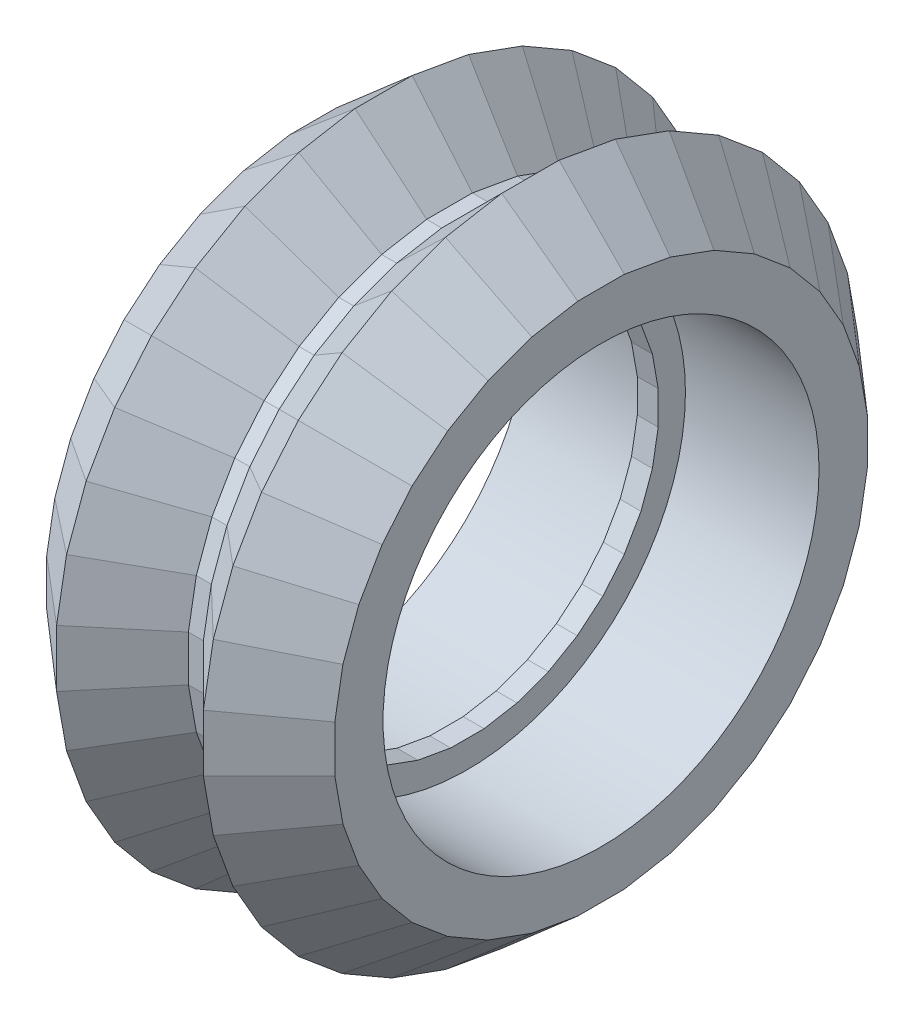
from build123d import *

# Parameters (mm, degrees)
SKETCH3_R          = 8
CUT_EXTRUDE1_DEPTH = 5
CUT_EXTRUDE2_START = 5
SKETCH4_R          = 8
CUT_EXTRUDE2_DEPTH = 5


with BuildPart() as part:
    # Sweep3: sweep along a path in Sketch2
    with BuildLine(Plane(origin=(0, 0, 0), x_dir=(0, 0, -1), z_dir=(1, 0, 0))) as sweep3_path:
        Line((3.117692302, -11.635386072), (5.090791138, -10.917236827))
        Line((5.090791138, -10.917236827), (6.909208862, -9.867372864))
        Line((6.909208862, -9.867372864), (8.517693771, -8.517693771))
        Line((8.517693771, -8.517693771), (9.867372864, -6.909208862))
        Line((9.867372864, -6.909208862), (10.917236827, -5.090791138))
        Line((10.917236827, -5.090791138), (11.635386072, -3.117692302))
        Line((11.635386072, -3.117692302), (12, -1.049863962))
        Line((12, -1.049863962), (12, 1.049863962))
        Line((12, 1.049863962), (11.635386072, 3.117692302))
        Line((11.635386072, 3.117692302), (10.917236827, 5.090791138))
        Line((10.917236827, 5.090791138), (9.867372864, 6.909208862))
        Line((9.867372864, 6.909208862), (8.517693771, 8.517693771))
        Line((8.517693771, 8.517693771), (6.909208862, 9.867372864))
        Line((6.909208862, 9.867372864), (5.090791138, 10.917236827))
        Line((5.090791138, 10.917236827), (3.117692302, 11.635386072))
        Line((3.117692302, 11.635386072), (1.049863962, 12))
        Line((1.049863962, 12), (-1.049863962, 12))
        Line((-1.049863962, 12), (-3.117692302, 11.635386072))
        Line((-3.117692302, 11.635386072), (-5.090791138, 10.917236827))
        Line((-5.090791138, 10.917236827), (-6.909208862, 9.867372864))
        Line((-6.909208862, 9.867372864), (-8.517693771, 8.517693771))
        Line((-8.517693771, 8.517693771), (-9.867372864, 6.909208862))
        Line((-9.867372864, 6.909208862), (-10.917236827, 5.090791138))
        Line((-10.917236827, 5.090791138), (-11.635386072, 3.117692302))
        Line((-11.635386072, 3.117692302), (-12, 1.049863962))
        Line((-12, 1.049863962), (-12, -1.049863962))
        Line((-12, -1.049863962), (-11.635386072, -3.117692302))
        Line((-11.635386072, -3.117692302), (-10.917236827, -5.090791138))
        Line((-10.917236827, -5.090791138), (-9.867372864, -6.909208862))
        Line((-9.867372864, -6.909208862), (-8.517693771, -8.517693771))
        Line((-8.517693771, -8.517693771), (-6.909208862, -9.867372864))
        Line((-6.909208862, -9.867372864), (-5.090791138, -10.917236827))
        Line((-5.090791138, -10.917236827), (-3.117692302, -11.635386072))
        Line((-3.117692302, -11.635386072), (-1.049863962, -12))
        Line((-1.049863962, -12), (1.049863962, -12))
        Line((1.049863962, -12), (3.117692302, -11.635386072))
    # Sketch1 → Sweep3 (sweep)
    with BuildSketch(Plane.XY):
        Polygon((-0.275, 9.581694808), (0.275, 9.581694808), (2.693305192, 12), (5.28627646, 9.77), (5.28627646, 7.782971269), (5.003305192, 7.5), (0.383305192, 7.5), (0.383305192, 7), (-0.383305192, 7), (-0.383305192, 7.5), (-5.003305192, 7.5), (-5.28627646, 7.782971269), (-5.28627646, 9.77), (-2.693305192, 12), align=None)
    sweep(path=sweep3_path.line, transition=Transition.RIGHT)

    # Sketch3 → Cut-Extrude1 (cut)
    with BuildSketch(Plane.ZY.offset(0.383305192)):
        Circle(SKETCH3_R)
    extrude(amount=CUT_EXTRUDE1_DEPTH, mode=Mode.SUBTRACT)

    # Sketch4 → Cut-Extrude2 (cut)
    with BuildSketch(Plane(origin=(0.383305192, 0, 0), x_dir=(0, 0, -1), z_dir=(1, 0, 0)).offset(CUT_EXTRUDE2_START)):
        with Locations(Location((0, 0, 0), (0, 0, 180))):
            Circle(SKETCH4_R)
    extrude(amount=-CUT_EXTRUDE2_DEPTH, mode=Mode.SUBTRACT)


solid = part.part
